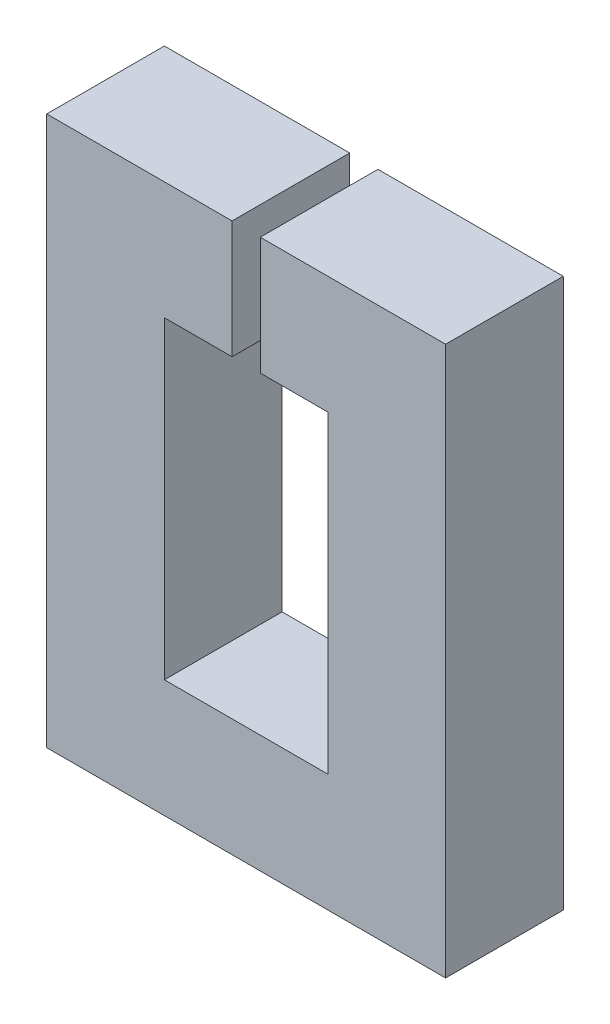
from build123d import *

# Parameters (mm, degrees)
AUFSATZ_LINEAR_AUSTRAGEN1_DEPTH = 30


with BuildPart() as part:
    # Skizze1 → Aufsatz-Linear austragen1 (new body)
    with BuildSketch(Plane.XY):
        Polygon((-20.85, 39.975), (-20.85, -39.975), (20.85, -39.975), (20.85, 39.975), (3.6, 39.975), (3.6, 69.975), (50.85, 69.975), (50.85, -69.975), (-50.85, -69.975), (-50.85, 69.975), (-3.6, 69.975), (-3.6, 39.975), align=None)
    extrude(amount=AUFSATZ_LINEAR_AUSTRAGEN1_DEPTH)


solid = part.part
